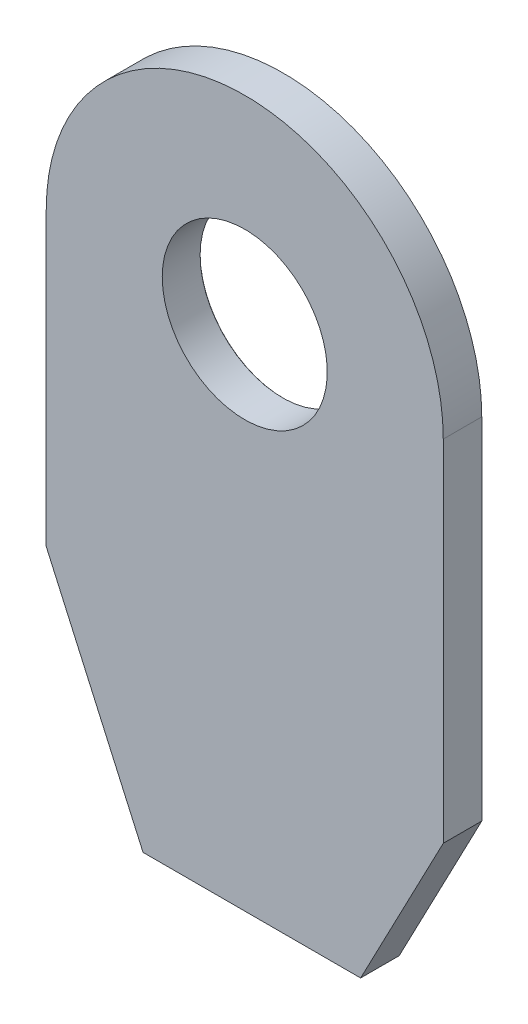
from build123d import *

# Parameters (mm, degrees)
BOSS_EXTRUDE1_DEPTH = 1.54


with BuildPart() as part:
    # Sketch1 → Boss-Extrude1 (new body)
    with BuildSketch(Plane.XY):
        with BuildLine():
            Line((7.939999995, -14.001333096), (7.939999995, 0))
            ThreePointArc((7.939999995, 0), (0, 7.939999995), (-7.939999995, 0))
            Line((-7.939999995, 0), (-7.939999995, -11.661341892))
            Line((-7.939999995, -11.661341892), (-4.068061328, -20.32))
            Line((-4.068061328, -20.32), (4.6346404, -20.32))
            Line((4.6346404, -20.32), (7.939999995, -14.001333096))
        make_face()
    extrude(amount=BOSS_EXTRUDE1_DEPTH)

    # Sketch3 → M6 Clearance Hole1 (revolve, cut)
    with BuildSketch(Plane.YZ):
        Polygon((0, 0), (0, 1.54), (3.3, 1.54), (3.3, 0.025), (3.325, 0), align=None)
    revolve(axis=Axis((0, 0, -6.35), (0, 0, 1)), mode=Mode.SUBTRACT)


solid = part.part
